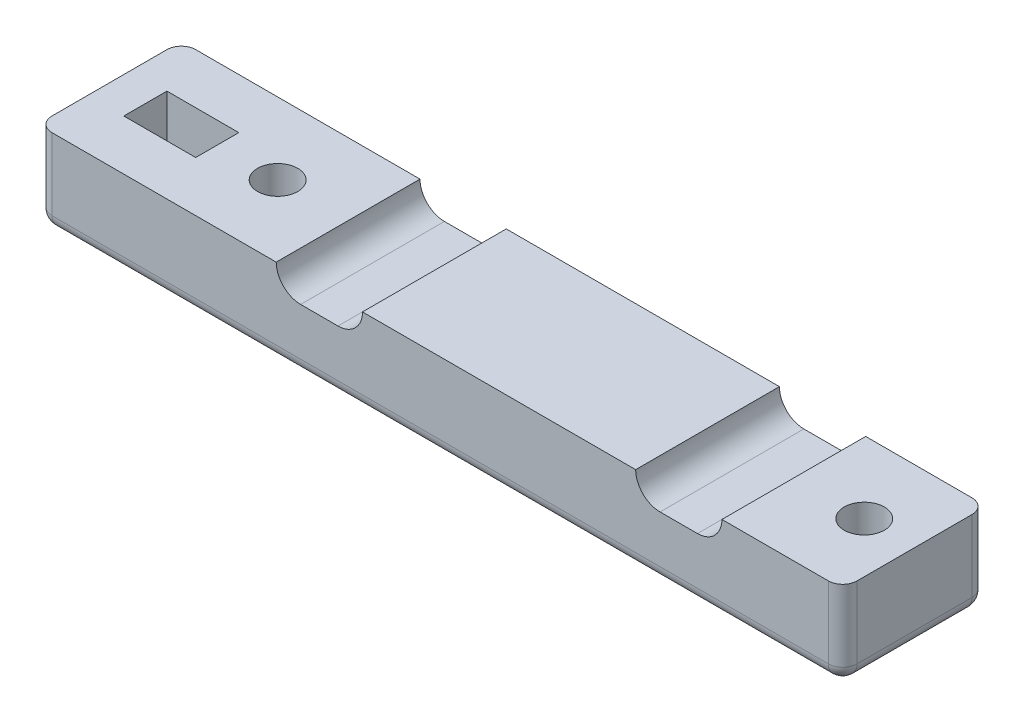
from build123d import *

# Parameters (mm, degrees)
SKETCH1_W                 = 56
SKETCH1_H                 = 10
SKETCH1_R                 = 1.4
SKETCH1_W_2               = 5
SKETCH1_H_2               = 3
BASE_DEPTH                = 6
BASKET_WIRE_GROOVES_DEPTH = 31.331501776
F_1MM_EDGE_FILLETS_R      = 1


with BuildPart() as part:
    # Sketch1 → Base (new body)
    with BuildSketch(Plane(origin=(0, 0, 0), x_dir=(1, 0, 0), z_dir=(0, 1, 0))):
        Rectangle(SKETCH1_W, SKETCH1_H)
        with Locations((-16.3, 0)):
            Circle(SKETCH1_R, mode=Mode.SUBTRACT)
        with Locations((24.5, 0)):
            Circle(SKETCH1_R, mode=Mode.SUBTRACT)
        with Locations((-23, 0)):
            Rectangle(SKETCH1_W_2, SKETCH1_H_2, mode=Mode.SUBTRACT)
    extrude(amount=BASE_DEPTH)

    # Sketch2 → Basket Wire Grooves (cut, through all)
    with BuildSketch(Plane(origin=(0, 0, -5), x_dir=(-1, 0, 0), z_dir=(0, 0, -1))):
        with BuildLine():
            Line((-13.6, 6), (-19.6, 6))
            ThreePointArc((-19.6, 6), (-19.102081528, 4.797918472), (-17.9, 4.3))
            Line((-17.9, 4.3), (-15.3, 4.3))
            ThreePointArc((-15.3, 4.3), (-14.097918472, 4.797918472), (-13.6, 6))
        make_face()
        with BuildLine():
            Line((5.4, 6), (11.4, 6))
            ThreePointArc((11.4, 6), (10.902081528, 4.797918472), (9.7, 4.3))
            Line((9.7, 4.3), (7.1, 4.3))
            ThreePointArc((7.1, 4.3), (5.897918472, 4.797918472), (5.4, 6))
        make_face()
    extrude(amount=-BASKET_WIRE_GROOVES_DEPTH, mode=Mode.SUBTRACT)

    # 1mm Edge Fillets
    f_1mm_edge_fillets_edges = [part.edges().sort_by_distance(p)[0] for p in [
        (28, 3, -5),
        (28, 3, 5),
        (-28, 3, -5),
        (-28, 3, 5),
        (-28, 0, 0),
        (0, 0, -5),
        (0, 0, 5),
        (28, 0, 0),
    ]]
    fillet(f_1mm_edge_fillets_edges, radius=F_1MM_EDGE_FILLETS_R)


solid = part.part
